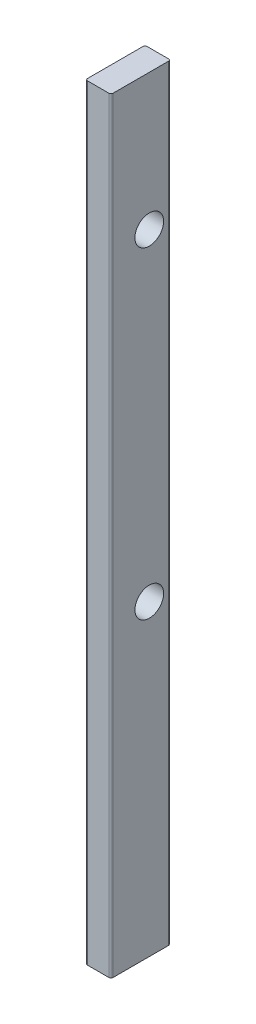
from build123d import *

# Parameters (mm, degrees)
SKETCH1_W           = 38.1
SKETCH1_H           = 88.9
BOSS_EXTRUDE1_DEPTH = 1143
SKETCH2_R           = 21.43125
CUT_EXTRUDE4_DEPTH  = 1145.498323502
FILLET1_R           = 3.175


with BuildPart() as part:
    # Sketch1 → Boss-Extrude1 (new body)
    with BuildSketch(Plane(origin=(0, 0, 0), x_dir=(1, 0, 0), z_dir=(0, 1, 0))):
        Rectangle(SKETCH1_W, SKETCH1_H)
    extrude(amount=BOSS_EXTRUDE1_DEPTH)

    # Sketch2 → Cut-Extrude4 (cut, through all)
    with BuildSketch(Plane(origin=(-19.05, 0, 0), x_dir=(0, 0, -1), z_dir=(1, 0, 0))):
        with Locations(Location((12.7, 458.7875, 0), (0, 0, 180))):
            Circle(SKETCH2_R)
        with Locations(Location((12.7, 939.8, 0), (0, 0, 180))):
            Circle(SKETCH2_R)
    extrude(amount=CUT_EXTRUDE4_DEPTH, mode=Mode.SUBTRACT)

    # Fillet1
    fillet1_edges = [part.edges().sort_by_distance(p)[0] for p in [
        (19.05, 571.5, 44.45),
        (-19.05, 571.5, 44.45),
        (-19.05, 571.5, -44.45),
        (19.05, 571.5, -44.45),
    ]]
    fillet(fillet1_edges, radius=FILLET1_R)


solid = part.part
